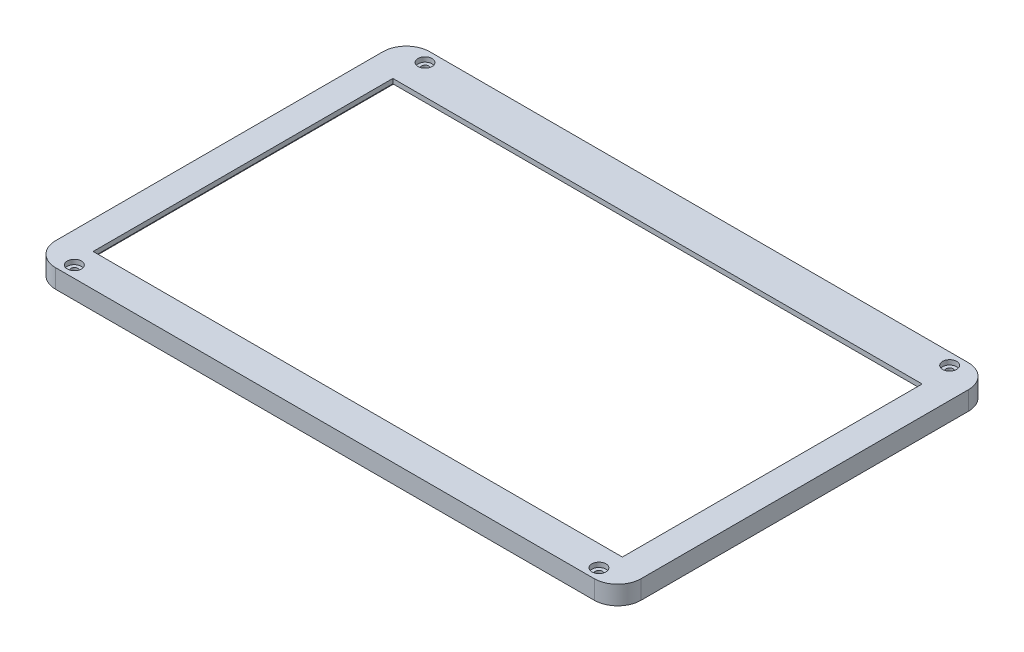
from build123d import *

# Parameters (mm, degrees)
SKETCH_1_W          = 250
SKETCH_1_H          = 156
SKETCH_1_W_2        = 226
SKETCH_1_H_2        = 128
EXTRUDE_1_DEPTH     = 8
SKETCH_2_W          = 235.5
SKETCH_2_H          = 139.5
CUT_EXTRUDE_3_DEPTH = 6
SKETCH_11_W         = 250
SKETCH_11_H         = 8
EXTRUDE_3_DEPTH     = 3.75
CUT_EXTRUDE_4_DEPTH = 10
SKETCH_13_R         = 1.5
CUT_EXTRUDE_5_DEPTH = 10
SKETCH_14_R         = 3
CUT_EXTRUDE_6_DEPTH = 2


with BuildPart() as part:
    # 草图1 → 凸台-拉伸1 (new body)
    with BuildSketch(Plane(origin=(0, 0, 0), x_dir=(1, 0, 0), z_dir=(0, 1, 0))):
        with Locations((25.659327926, -14.898030127)):
            Rectangle(SKETCH_1_W, SKETCH_1_H)
        with Locations((25.659327926, -14.898030127)):
            Rectangle(SKETCH_1_W_2, SKETCH_1_H_2, mode=Mode.SUBTRACT)
    extrude(amount=EXTRUDE_1_DEPTH)

    # 草图2 → 切除-拉伸3 (cut)
    with BuildSketch(Plane.XZ):
        with Locations((24.659327926, 12.898030127)):
            Rectangle(SKETCH_2_W, SKETCH_2_H)
    extrude(amount=-CUT_EXTRUDE_3_DEPTH, mode=Mode.SUBTRACT)

    # 草图11 → 凸台-拉伸3 (add)
    with BuildSketch(Plane(origin=(0, 0, -63.101969873), x_dir=(-1, 0, 0), z_dir=(0, 0, -1))):
        with Locations((-25.659327926, 4)):
            Rectangle(SKETCH_11_W, SKETCH_11_H)
    extrude(amount=EXTRUDE_3_DEPTH)

    # 草图12 → 切除-拉伸4 (cut)
    with BuildSketch(Plane.XZ):
        with BuildLine():
            Line((-89.340672074, 92.898030127), (-99.340672074, 92.898030127))
            Line((-99.340672074, 92.898030127), (-99.340672074, 82.898030127))
            ThreePointArc((-99.340672074, 82.898030127), (-96.411739886, 89.969097939), (-89.340672074, 92.898030127))
        make_face()
        with BuildLine():
            Line((-99.340672074, -56.851969873), (-99.340672074, -66.851969873))
            Line((-99.340672074, -66.851969873), (-89.340672074, -66.851969873))
            ThreePointArc((-89.340672074, -66.851969873), (-96.411739886, -63.923037684), (-99.340672074, -56.851969873))
        make_face()
        with BuildLine():
            Line((140.659327926, -66.851969873), (150.659327926, -66.851969873))
            Line((150.659327926, -66.851969873), (150.659327926, -56.851969873))
            ThreePointArc((150.659327926, -56.851969873), (147.730395738, -63.923037684), (140.659327926, -66.851969873))
        make_face()
        with BuildLine():
            Line((150.659327926, 82.898030127), (150.659327926, 92.898030127))
            Line((150.659327926, 92.898030127), (140.659327926, 92.898030127))
            ThreePointArc((140.659327926, 92.898030127), (147.730395738, 89.969097939), (150.659327926, 82.898030127))
        make_face()
    extrude(amount=-CUT_EXTRUDE_4_DEPTH, mode=Mode.SUBTRACT)

    # 草图13 → 切除-拉伸5 (cut)
    with BuildSketch(Plane.XZ):
        with Locations(Location((-86.340672074, 87.898030127, 0), (0, 0, 270))):
            Circle(SKETCH_13_R)
        with Locations(Location((137.659327926, 87.898030127, 0), (0, 0, 270))):
            Circle(SKETCH_13_R)
        with Locations(Location((137.659327926, -61.851969873, 0), (0, 0, 270))):
            Circle(SKETCH_13_R)
        with Locations(Location((-86.340672074, -61.851969873, 0), (0, 0, 270))):
            Circle(SKETCH_13_R)
    extrude(amount=-CUT_EXTRUDE_5_DEPTH, mode=Mode.SUBTRACT)

    # 草图14 → 切除-拉伸6 (cut)
    with BuildSketch(Plane(origin=(0, 8, 0), x_dir=(1, 0, 0), z_dir=(0, 1, 0))):
        with Locations(Location((-86.340672074, 61.851969873, 0), (0, 0, 270))):
            Circle(SKETCH_14_R)
        with Locations(Location((137.659327926, 61.851969873, 0), (0, 0, 270))):
            Circle(SKETCH_14_R)
        with Locations(Location((137.659327926, -87.898030127, 0), (0, 0, 270))):
            Circle(SKETCH_14_R)
        with Locations(Location((-86.340672074, -87.898030127, 0), (0, 0, 270))):
            Circle(SKETCH_14_R)
    extrude(amount=-CUT_EXTRUDE_6_DEPTH, mode=Mode.SUBTRACT)


solid = part.part
